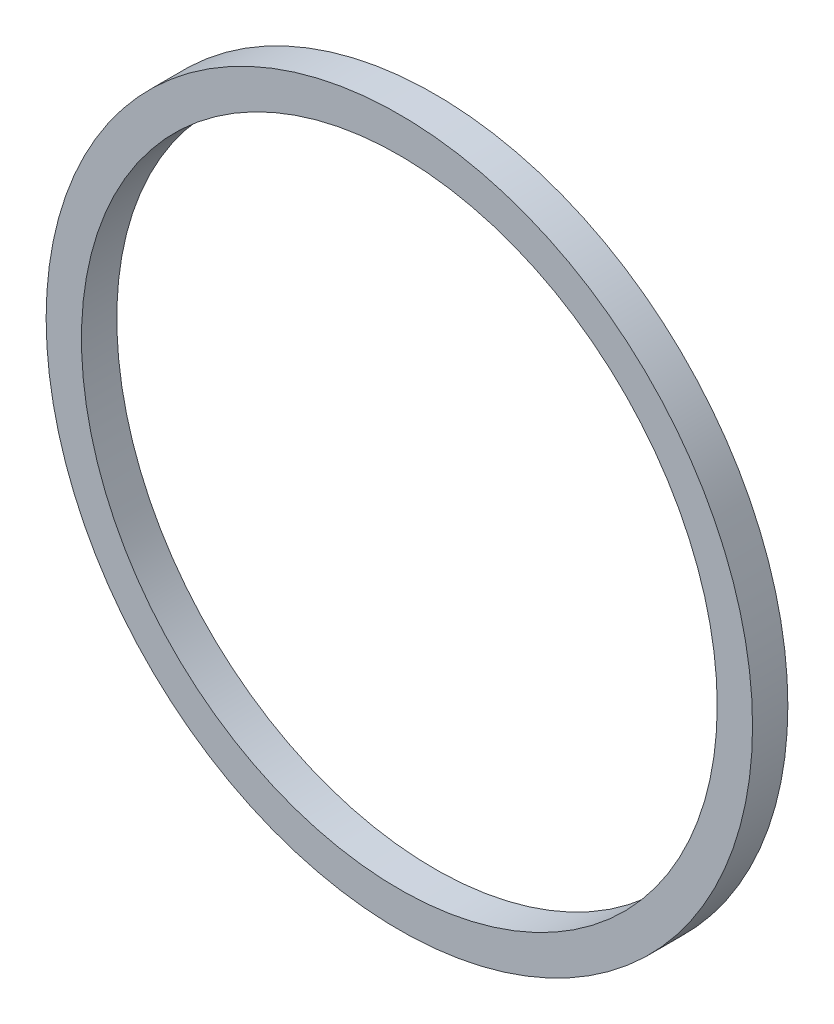
from build123d import *

# Parameters (mm, degrees)
SKETCH1_R      = 508
SKETCH1_R_2    = 457.2
EXTRUDE1_DEPTH = 50.8


with BuildPart() as part:
    # Sketch1 → Extrude1 (new body)
    with BuildSketch(Plane.XY):
        Circle(SKETCH1_R)
        Circle(SKETCH1_R_2, mode=Mode.SUBTRACT)
    extrude(amount=-EXTRUDE1_DEPTH)


solid = part.part
